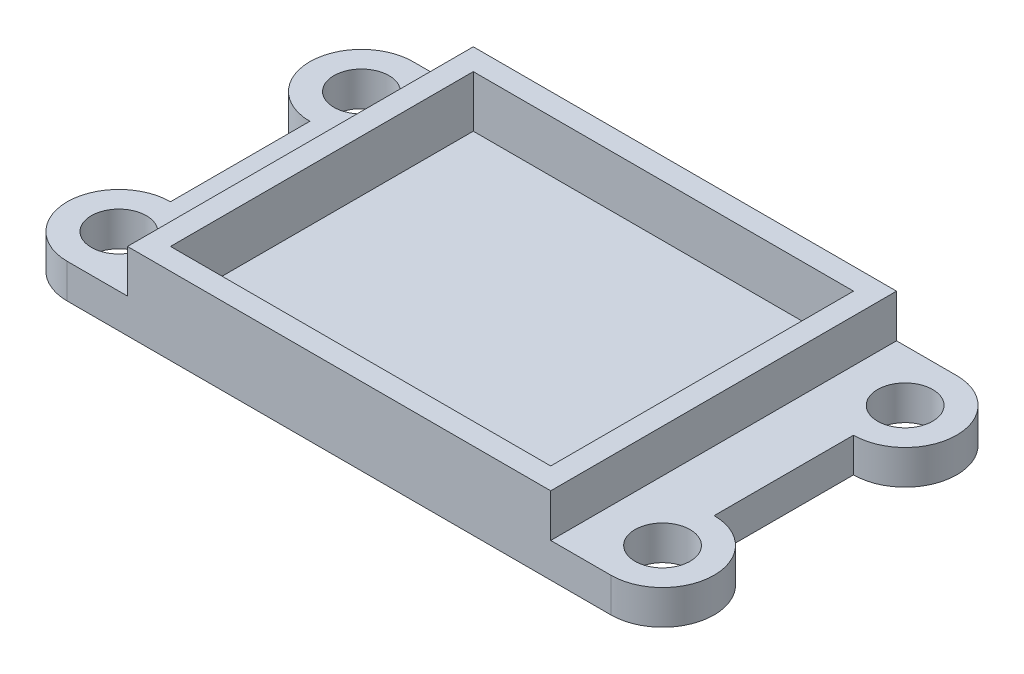
from build123d import *

# Parameters (mm, degrees)
SKETCH1_W           = 24.6
SKETCH1_H           = 20.1
BOSS_EXTRUDE1_DEPTH = 1.5
SKETCH2_W           = 24.6
SKETCH2_H           = 20.1
SKETCH2_W_2         = 22.1
SKETCH2_H_2         = 17.6
BOSS_EXTRUDE2_DEPTH = 3
SKETCH4_R           = 1.6
BOSS_EXTRUDE4_DEPTH = 2
SKETCH8_W           = 3.5
SKETCH8_H           = 8.1
BOSS_EXTRUDE5_DEPTH = 2


with BuildPart() as part:
    # Sketch1 → Boss-Extrude1 (new body)
    with BuildSketch(Plane(origin=(0, 0, 0), x_dir=(1, 0, 0), z_dir=(0, 1, 0))):
        Rectangle(SKETCH1_W, SKETCH1_H)
    extrude(amount=BOSS_EXTRUDE1_DEPTH)

    # Sketch2 → Boss-Extrude2 (add)
    with BuildSketch(Plane(origin=(0, 1.5, 0), x_dir=(1, 0, 0), z_dir=(0, 1, 0))):
        Rectangle(SKETCH2_W, SKETCH2_H)
        Rectangle(SKETCH2_W_2, SKETCH2_H_2, mode=Mode.SUBTRACT)
    extrude(amount=BOSS_EXTRUDE2_DEPTH)

    # Sketch4 → Boss-Extrude4 (add)
    # profile 1 of 4: a face of its own
    with BuildSketch(Plane(origin=(0, 0, 0), x_dir=(1, 0, 0), z_dir=(0, 1, 0))):
        with BuildLine():
            Line((15.8, 10.05), (12.3, 10.05))
            Line((12.3, 10.05), (12.3, 4.05))
            Line((12.3, 4.05), (15.8, 4.05))
            ThreePointArc((15.8, 4.05), (18.8, 7.05), (15.8, 10.05))
        make_face()
        with Locations(Location((15.8, 7.05, 0), (0, 0, 270))):
            Circle(SKETCH4_R, mode=Mode.SUBTRACT)
    # profile 2 of 4: a face of its own
    with BuildSketch(Plane(origin=(0, 0, 0), x_dir=(1, 0, 0), z_dir=(0, 1, 0))):
        with BuildLine():
            Line((-15.8, 4.05), (-12.3, 4.05))
            Line((-12.3, 4.05), (-12.3, 10.05))
            Line((-12.3, 10.05), (-15.8, 10.05))
            ThreePointArc((-15.8, 10.05), (-18.8, 7.05), (-15.8, 4.05))
        make_face()
        with Locations(Location((-15.8, 7.05, 0), (0, 0, 90))):
            Circle(SKETCH4_R, mode=Mode.SUBTRACT)
    # profile 3 of 4: a face of its own
    with BuildSketch(Plane(origin=(0, 0, 0), x_dir=(1, 0, 0), z_dir=(0, 1, 0))):
        with BuildLine():
            Line((15.8, -4.05), (12.3, -4.05))
            Line((12.3, -4.05), (12.3, -10.05))
            Line((12.3, -10.05), (15.8, -10.05))
            ThreePointArc((15.8, -10.05), (18.8, -7.05), (15.8, -4.05))
        make_face()
        with Locations(Location((15.8, -7.05, 0), (0, 0, 90))):
            Circle(SKETCH4_R, mode=Mode.SUBTRACT)
    # profile 4 of 4: a face of its own
    with BuildSketch(Plane(origin=(0, 0, 0), x_dir=(1, 0, 0), z_dir=(0, 1, 0))):
        with BuildLine():
            Line((-15.8, -10.05), (-12.3, -10.05))
            Line((-12.3, -10.05), (-12.3, -4.05))
            Line((-12.3, -4.05), (-15.8, -4.05))
            ThreePointArc((-15.8, -4.05), (-18.8, -7.05), (-15.8, -10.05))
        make_face()
        with Locations(Location((-15.8, -7.05, 0), (0, 0, 270))):
            Circle(SKETCH4_R, mode=Mode.SUBTRACT)
    extrude(amount=BOSS_EXTRUDE4_DEPTH)

    # Sketch8 → Boss-Extrude5 (add, through all)
    with BuildSketch(Plane(origin=(0, 2, 0), x_dir=(1, 0, 0), z_dir=(0, 1, 0))):
        with Locations((-14.05, 0)):
            Rectangle(SKETCH8_W, SKETCH8_H)
        with Locations((14.05, 0)):
            Rectangle(SKETCH8_W, SKETCH8_H)
    extrude(amount=-BOSS_EXTRUDE5_DEPTH)


solid = part.part
